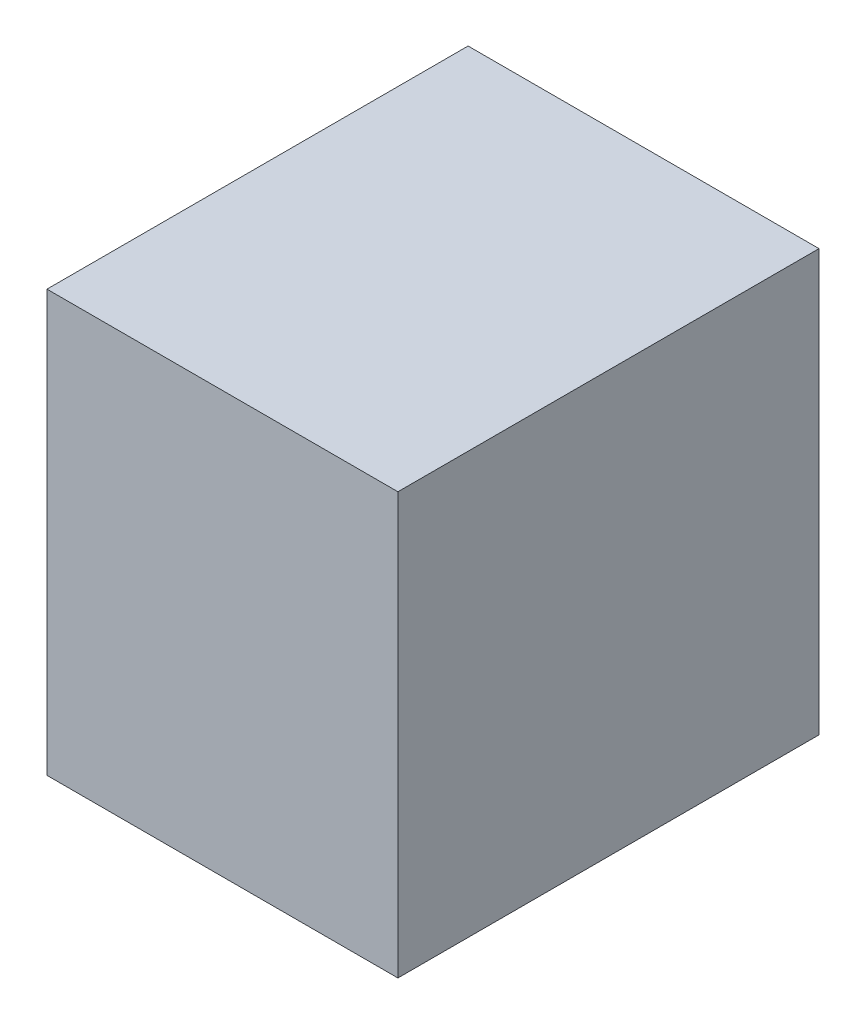
from build123d import *

# Parameters (mm, degrees)
PACK_FLAP_SERVO_25KGCM_3_1_START = -170
SKETCH1_W                        = 50
SKETCH1_H                        = 60
PACK_FLAP_SERVO_25KGCM_3_1_DEPTH = 60


with BuildPart() as part:
    # Sketch1 → PACK_flap_servo_25kgcm_3_1 (new body)
    with BuildSketch(Plane.XY.offset(PACK_FLAP_SERVO_25KGCM_3_1_START)):
        with Locations((550, 670)):
            Rectangle(SKETCH1_W, SKETCH1_H)
    extrude(amount=-PACK_FLAP_SERVO_25KGCM_3_1_DEPTH)


solid = part.part
